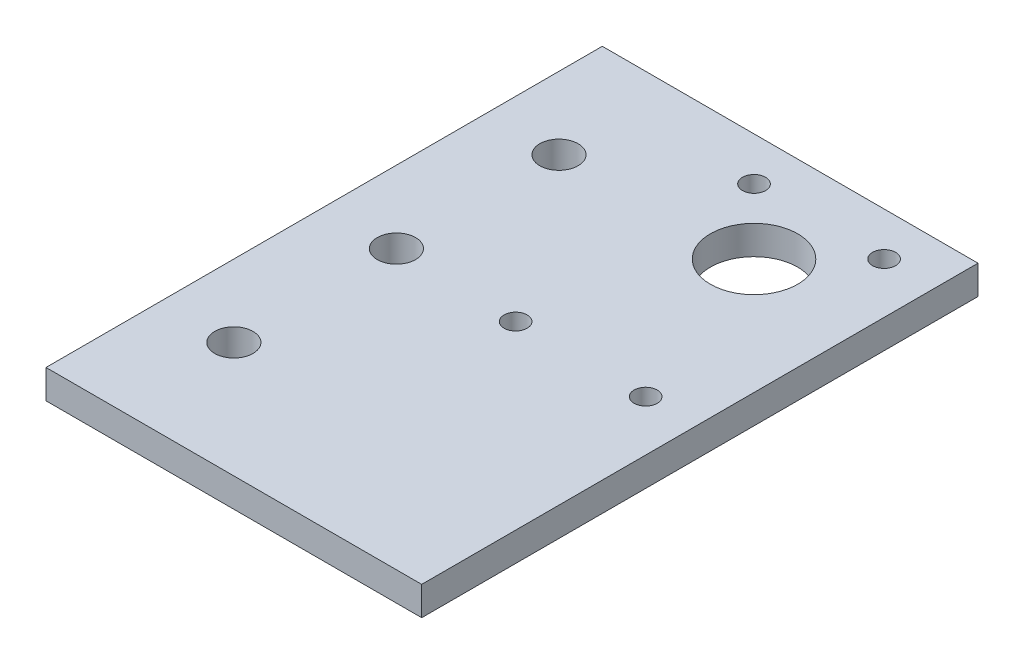
from build123d import *

# Parameters (mm, degrees)
SKETCH1_W           = 52
SKETCH1_H           = 77
SKETCH1_R           = 1.6
SKETCH1_R_2         = 6.05
BOSS_EXTRUDE1_DEPTH = 4


with BuildPart() as part:
    # Sketch1 → Boss-Extrude1 (new body)
    with BuildSketch(Plane(origin=(0, 0, 0), x_dir=(1, 0, 0), z_dir=(0, 1, 0))):
        with Locations((26, -38.5)):
            Rectangle(SKETCH1_W, SKETCH1_H)
        with BuildLine():
            ThreePointArc((12.65, -61), (8.12616703, -62.87383297), (10, -58.35))
            ThreePointArc((10, -58.35), (11.87383297, -59.12616703), (12.65, -61))
        make_face(mode=Mode.SUBTRACT)
        with Locations((27, -39)):
            Circle(SKETCH1_R, mode=Mode.SUBTRACT)
        with Locations((45, -39)):
            Circle(SKETCH1_R, mode=Mode.SUBTRACT)
        with BuildLine():
            ThreePointArc((10, -41.15), (7.35, -38.5), (10, -35.85))
            ThreePointArc((10, -35.85), (11.87383297, -36.62616703), (12.65, -38.5))
            ThreePointArc((12.65, -38.5), (11.87383297, -40.37383297), (10, -41.15))
        make_face(mode=Mode.SUBTRACT)
        with BuildLine():
            ThreePointArc((12.65, -16), (11.87383297, -17.87383297), (10, -18.65))
            ThreePointArc((10, -18.65), (8.12616703, -14.12616703), (12.65, -16))
        make_face(mode=Mode.SUBTRACT)
        with Locations((36, -15)):
            Circle(SKETCH1_R_2, mode=Mode.SUBTRACT)
        with Locations((27, -6)):
            Circle(SKETCH1_R, mode=Mode.SUBTRACT)
        with Locations((45, -6)):
            Circle(SKETCH1_R, mode=Mode.SUBTRACT)
    extrude(amount=BOSS_EXTRUDE1_DEPTH)


solid = part.part
